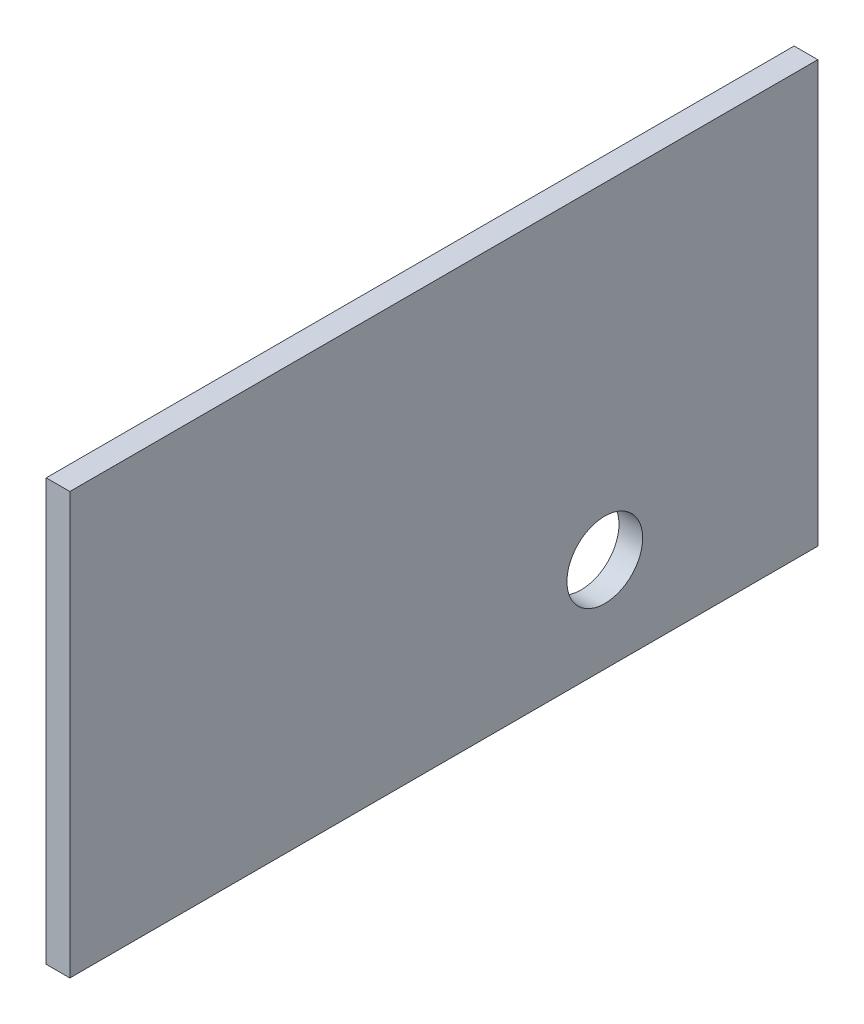
from build123d import *

# Parameters (mm, degrees)
SKETCH1_W           = 158
SKETCH1_H           = 89
BOSS_EXTRUDE1_DEPTH = 5
SKETCH2_R           = 8
CUT_EXTRUDE1_DEPTH  = 5


with BuildPart() as part:
    # Sketch1 → Boss-Extrude1 (new body)
    with BuildSketch(Plane(origin=(0, 0, 0), x_dir=(0, 0, -1), z_dir=(1, 0, 0))):
        with Locations((79, -44.5)):
            Rectangle(SKETCH1_W, SKETCH1_H)
    extrude(amount=BOSS_EXTRUDE1_DEPTH)

    # Sketch2 → Cut-Extrude1 (cut)
    with BuildSketch(Plane(origin=(5, 0, 0), x_dir=(0, 0, -1), z_dir=(1, 0, 0))):
        with Locations((113, -69)):
            Circle(SKETCH2_R)
    extrude(amount=-CUT_EXTRUDE1_DEPTH, mode=Mode.SUBTRACT)


solid = part.part
